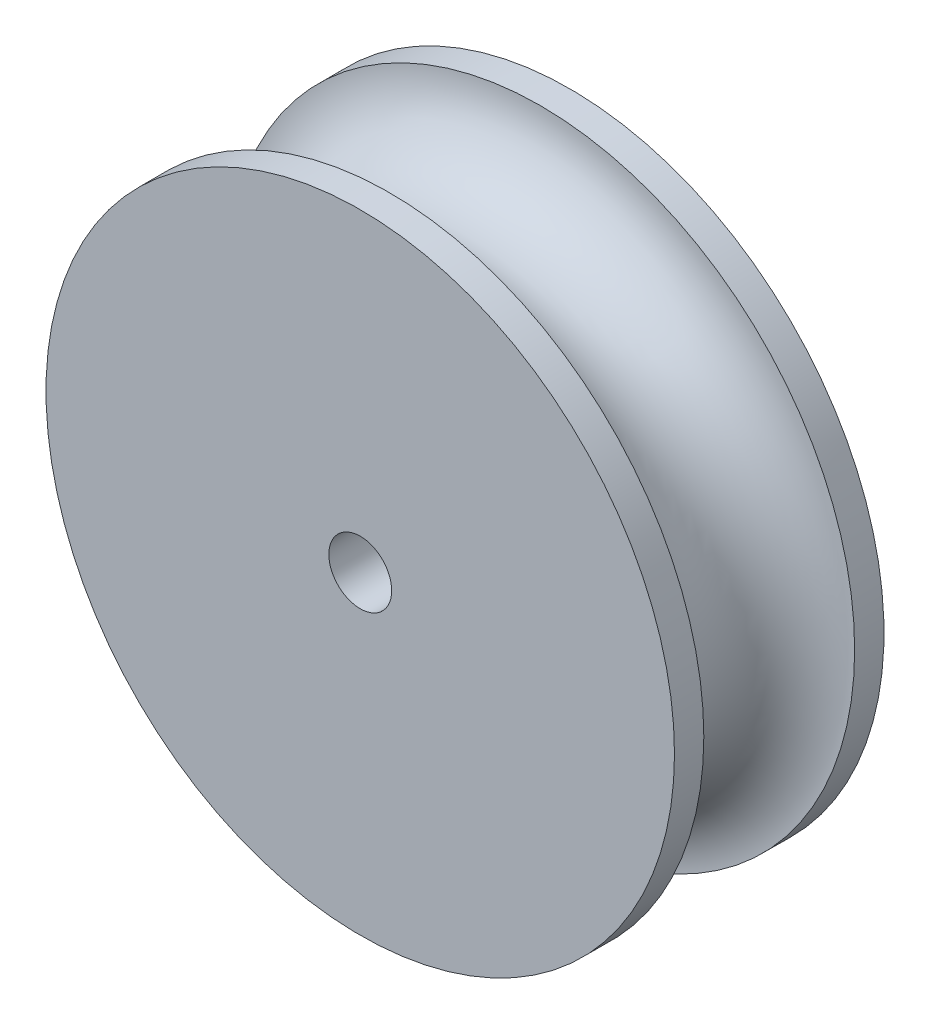
from build123d import *

# Parameters (mm, degrees)
SKETCH9_R                  = 38.1
BOSS_EXTRUDE2_DEPTH        = 3.556
BOSS_EXTRUDE3_START        = 3.556
SKETCH10_R                 = 38.1
BOSS_EXTRUDE3_DEPTH        = 3.556
F_3_4_0_3_DIAMETER_HOLE1_D = 7.62


with BuildPart() as part:
    # Sketch5 → Revolve1 (revolve)
    with BuildSketch(Plane(origin=(0, 0, 0), x_dir=(1, 0, 0), z_dir=(0, 1, 0)), mode=Mode.PRIVATE) as revolve1_sk:
        with BuildLine():
            Line((0, 0), (-38.1, 0))
            ThreePointArc((-38.1, 0), (-28.956, 9.144), (-38.1, 18.288))
            Line((-38.1, 18.288), (0, 18.288))
            Line((0, 18.288), (0, 0))
        make_face()
    revolve(revolve1_sk.sketch.rotate(Axis((0, 0, 0), (0, 0, -1)), 180), axis=Axis((0, 0, 0), (0, 0, -1)))

    # Sketch9 → Boss-Extrude2 (add)
    with BuildSketch(Plane.XY):
        Circle(SKETCH9_R)
    extrude(amount=BOSS_EXTRUDE2_DEPTH)

    # Sketch10 → Boss-Extrude3 (add)
    with BuildSketch(Plane(origin=(0, 0, -18.288), x_dir=(-1, 0, 0), z_dir=(0, 0, -1)).offset(BOSS_EXTRUDE3_START)):
        with Locations(Location((0, 0, 0), (0, 0, 180))):
            Circle(SKETCH10_R)
    extrude(amount=-BOSS_EXTRUDE3_DEPTH)

    # 3/4 (0.3) Diameter Hole1 (through all)
    with Locations(Plane.XY.offset(3.556)):
        with Locations((0, 0)):
            Hole(F_3_4_0_3_DIAMETER_HOLE1_D / 2)


solid = part.part
